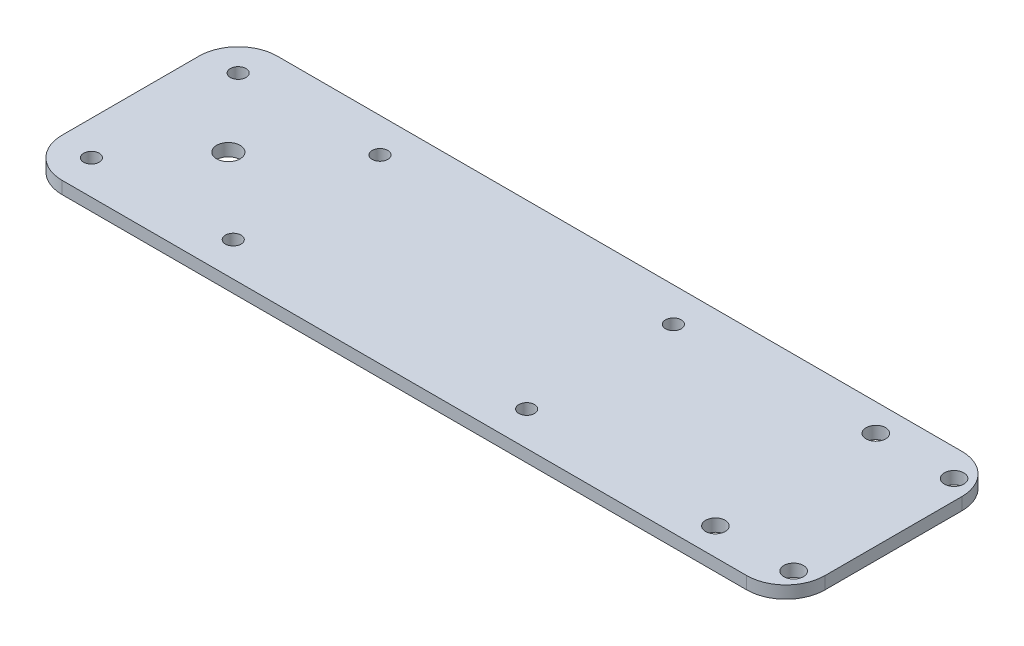
from build123d import *

# Parameters (mm, degrees)
SKETCH1_W             = 195
SKETCH1_H             = 55
BOSS_EXTRUDE1_DEPTH   = 3.175
FILLET1_R             = 10
F_6_0MM_DOWEL_HOLE1_D = 6
F_4_0MM_DOWEL_HOLE1_D = 4
F_5_0MM_DOWEL_HOLE1_D = 5


with BuildPart() as part:
    # Sketch1 → Boss-Extrude1 (new body)
    with BuildSketch(Plane(origin=(0, 0, 0), x_dir=(1, 0, 0), z_dir=(0, 1, 0))):
        with Locations((72.5, 0)):
            Rectangle(SKETCH1_W, SKETCH1_H)
    extrude(amount=BOSS_EXTRUDE1_DEPTH)

    # Fillet1
    fillet1_edges = [part.edges().sort_by_distance(p)[0] for p in [
        (-25, 1.5875, -27.5),
        (170, 1.5875, -27.5),
        (170, 1.5875, 27.5),
        (-25, 1.5875, 27.5),
    ]]
    fillet(fillet1_edges, radius=FILLET1_R)

    # Ø6.0mm Dowel Hole1 (through all)
    with Locations(Plane(origin=(0, 3.175, 0), x_dir=(1, 0, 0), z_dir=(0, 1, 0))):
        with Locations((0, 0)):
            Hole(F_6_0MM_DOWEL_HOLE1_D / 2)

    # Ø4.0mm Dowel Hole1 (through all)
    with Locations(Plane(origin=(0, 3.175, 0), x_dir=(1, 0, 0), z_dir=(0, 1, 0))):
        with Locations((-16.25, -18.75), (20, -18.75), (95, -18.75), (95, 18.75), (20, 18.75), (-16.25, 18.75)):
            Hole(F_4_0MM_DOWEL_HOLE1_D / 2)

    # Ø5.0mm Dowel Hole1 (through all)
    with Locations(Plane(origin=(0, 3.175, 0), x_dir=(1, 0, 0), z_dir=(0, 1, 0))):
        with Locations((165, 20.5), (145, 20.5), (165, -20.5), (145, -20.5)):
            Hole(F_5_0MM_DOWEL_HOLE1_D / 2)


solid = part.part
